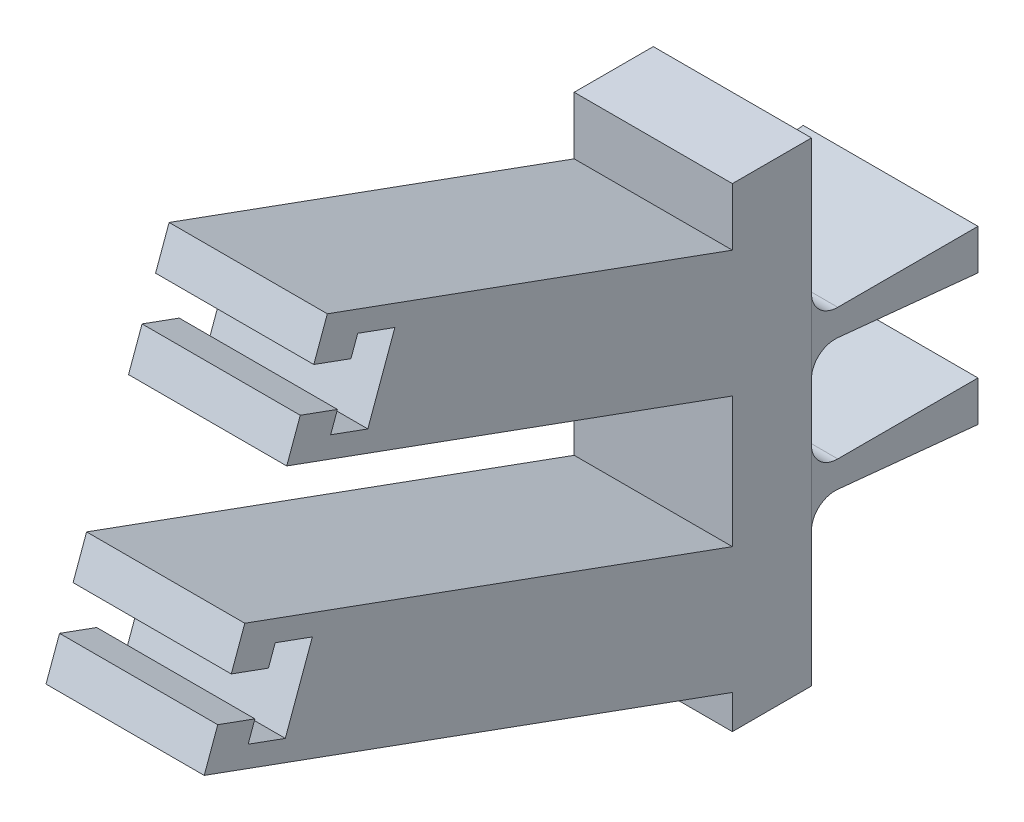
from build123d import *

# Parameters (mm, degrees)
SKETCH1_W                       = 20
SKETCH1_H                       = 60
BOSS_EXTRUDE1_DEPTH             = 10
SKETCH3_W                       = 20
SKETCH3_H                       = 3
BOSS_EXTRUDE2_DEPTH             = 20
BOSS_EXTRUDE2_DRAFT             = -3
BOSS_EXTRUDE2_PROFILE_2_DEPTH   = 20
BOSS_EXTRUDE2_PROFILE_2_DRAFT   = -3
FILLET1_R                       = 3
SKETCH7_W                       = 20
SKETCH7_H                       = 15
BOSS_EXTRUDE3_DEPTH             = 52
BOSS_EXTRUDE3_DIRECTION_2_REACH = 74.352
BOSS_EXTRUDE4_REACH             = 74.712
SKETCH11_W                      = 20
SKETCH11_H                      = 15
BOSS_EXTRUDE4_DIRECTION_2_DEPTH = 52
CUT_EXTRUDE2_START              = -20
CUT_EXTRUDE2_DEPTH              = 127.898033865


with BuildPart() as part:
    # Sketch1 → Boss-Extrude1 (new body)
    with BuildSketch(Plane.XY):
        with Locations((10, 30)):
            Rectangle(SKETCH1_W, SKETCH1_H)
    extrude(amount=BOSS_EXTRUDE1_DEPTH)


with BuildPart() as boss_extrude2_tool:
    # Sketch3 → Boss-Extrude2 (with draft: the straight prism first)
    with BuildSketch(Plane(origin=(0, 0, 0), x_dir=(-1, 0, 0), z_dir=(0, 0, -1))):
        with Locations((-10, 21.7)):
            Rectangle(SKETCH3_W, SKETCH3_H)
    extrude(amount=BOSS_EXTRUDE2_DEPTH)
    # Boss-Extrude2: the draft: its side faces are tilted about the plane it starts from
    boss_extrude2_sides = [boss_extrude2_tool.faces().sort_by_distance(p)[0] for p in [
        (20, 21.7, -10),
        (10, 20.2, -10),
        (0, 21.7, -10),
        (10, 23.2, -10),
    ]]
    draft(boss_extrude2_sides, Plane(origin=(0, 0, 0), x_dir=(-1, 0, 0), z_dir=(0, 0, -1)), BOSS_EXTRUDE2_DRAFT)


with BuildPart() as part_1:
    add(part.part)

    # Boss-Extrude2: add boss_extrude2_tool
    add(boss_extrude2_tool.part)


with BuildPart() as boss_extrude2_profile_2_tool:
    # Sketch3 → Boss-Extrude2 profile 2 (with draft: the straight prism first)
    with BuildSketch(Plane(origin=(0, 0, 0), x_dir=(-1, 0, 0), z_dir=(0, 0, -1))):
        with Locations((-10, 38.3)):
            Rectangle(SKETCH3_W, SKETCH3_H)
    extrude(amount=BOSS_EXTRUDE2_PROFILE_2_DEPTH)
    # Boss-Extrude2 profile 2: the draft: its side faces are tilted about the plane it starts from
    boss_extrude2_profile_2_sides = [boss_extrude2_profile_2_tool.faces().sort_by_distance(p)[0] for p in [
        (20, 38.3, -10),
        (10, 36.8, -10),
        (0, 38.3, -10),
        (10, 39.8, -10),
    ]]
    draft(boss_extrude2_profile_2_sides, Plane(origin=(0, 0, 0), x_dir=(-1, 0, 0), z_dir=(0, 0, -1)), BOSS_EXTRUDE2_PROFILE_2_DRAFT)


with BuildPart() as part_2:
    add(part_1.part)

    # Boss-Extrude2 profile 2: add boss_extrude2_profile_2_tool
    add(boss_extrude2_profile_2_tool.part)

    # Fillet1
    fillet1_edges = [part_2.edges().sort_by_distance(p)[0] for p in [
        (10, 23.2, 0),
        (10, 36.8, 0),
        (10, 20.2, 0),
        (10, 39.8, 0),
    ]]
    fillet(fillet1_edges, radius=FILLET1_R)

    # Sketch7 → Boss-Extrude3 (add)
    with BuildSketch(Plane(origin=(0, 10.232604755, 28.113850506), x_dir=(-1, 0, 0), z_dir=(0, 0.34202014332566943, 0.9396926207859081))):
        with Locations((-10, -8.113337756)):
            Rectangle(SKETCH7_W, SKETCH7_H)
    extrude(amount=BOSS_EXTRUDE3_DEPTH)

    # Boss-Extrude3 direction 2: up to this plane
    boss_extrude3_direction_2_end = Plane(origin=(0, 0, 10), z_dir=(0, 0, -1))
    # Sketch7 → Boss-Extrude3 direction 2 (add, up to the surface)
    with BuildSketch(Plane(origin=(0, 10.232604755, 28.113850506), x_dir=(-1, 0, 0), z_dir=(0, 0.34202014332566943, 0.9396926207859081)), mode=Mode.PRIVATE) as boss_extrude3_direction_2_sk1:
        with Locations((-10, -8.113337756)):
            Rectangle(SKETCH7_W, SKETCH7_H)
    boss_extrude3_direction_2_tool1 = split(extrude(boss_extrude3_direction_2_sk1.sketch, amount=-BOSS_EXTRUDE3_DIRECTION_2_REACH, mode=Mode.PRIVATE), bisect_by=boss_extrude3_direction_2_end, keep=Keep.BOTH, mode=Mode.PRIVATE)
    add(boss_extrude3_direction_2_tool1.solids().sort_by_distance((10, 17.856648, 25.338926))[0])

    # Boss-Extrude4: up to this plane
    boss_extrude4_end = Plane(origin=(0, 0, 10), z_dir=(0, 0, -1))
    # Sketch11 → Boss-Extrude4 (add, up to the surface)
    with BuildSketch(Plane(origin=(0, 10.232604755, 28.113850506), x_dir=(-1, 0, 0), z_dir=(0, 0.34202014332566943, 0.9396926207859081)), mode=Mode.PRIVATE) as boss_extrude4_sk1:
        with Locations((-10, -38.613337756)):
            Rectangle(SKETCH11_W, SKETCH11_H)
    boss_extrude4_tool1 = split(extrude(boss_extrude4_sk1.sketch, amount=-BOSS_EXTRUDE4_REACH, mode=Mode.PRIVATE), bisect_by=boss_extrude4_end, keep=Keep.BOTH, mode=Mode.PRIVATE)
    add(boss_extrude4_tool1.solids().sort_by_distance((10, 46.517273, 14.907311))[0])

    # Sketch11 → Boss-Extrude4 direction 2 (add)
    with BuildSketch(Plane(origin=(0, 10.232604755, 28.113850506), x_dir=(-1, 0, 0), z_dir=(0, 0.34202014332566943, 0.9396926207859081))):
        with Locations((-10, -38.613337756)):
            Rectangle(SKETCH11_W, SKETCH11_H)
    extrude(amount=BOSS_EXTRUDE4_DIRECTION_2_DEPTH)

    # Sketch9 → Cut-Extrude2 (cut)
    with BuildSketch(Plane.ZY.offset(CUT_EXTRUDE2_START)):
        Polygon((275.181377297, 111.452308492), (73.347891487, 37.990927379), (68.649428383, 36.280826662), (67.794378024, 38.630058214), (63.09591492, 36.919957498), (66.516116354, 27.52303129), (71.214579458, 29.233132007), (70.359529099, 31.582363559), (75.057992203, 33.292464275), (276.891478013, 106.753845388), (680.558449633, 253.676607614), (678.848348917, 258.375070718), align=None)
    cut_extrude2 = extrude(amount=CUT_EXTRUDE2_DEPTH, mode=Mode.SUBTRACT)

    # Mirror1: Cut-Extrude2 across plane
    add(cut_extrude2.mirror(Plane(origin=(0, 21.954356086, -7.990732128), x_dir=(0, 0.3420201433256692, 0.9396926207859082), z_dir=(0, -0.9396926207859083, 0.3420201433256692))), mode=Mode.SUBTRACT)


solid = part_2.part
